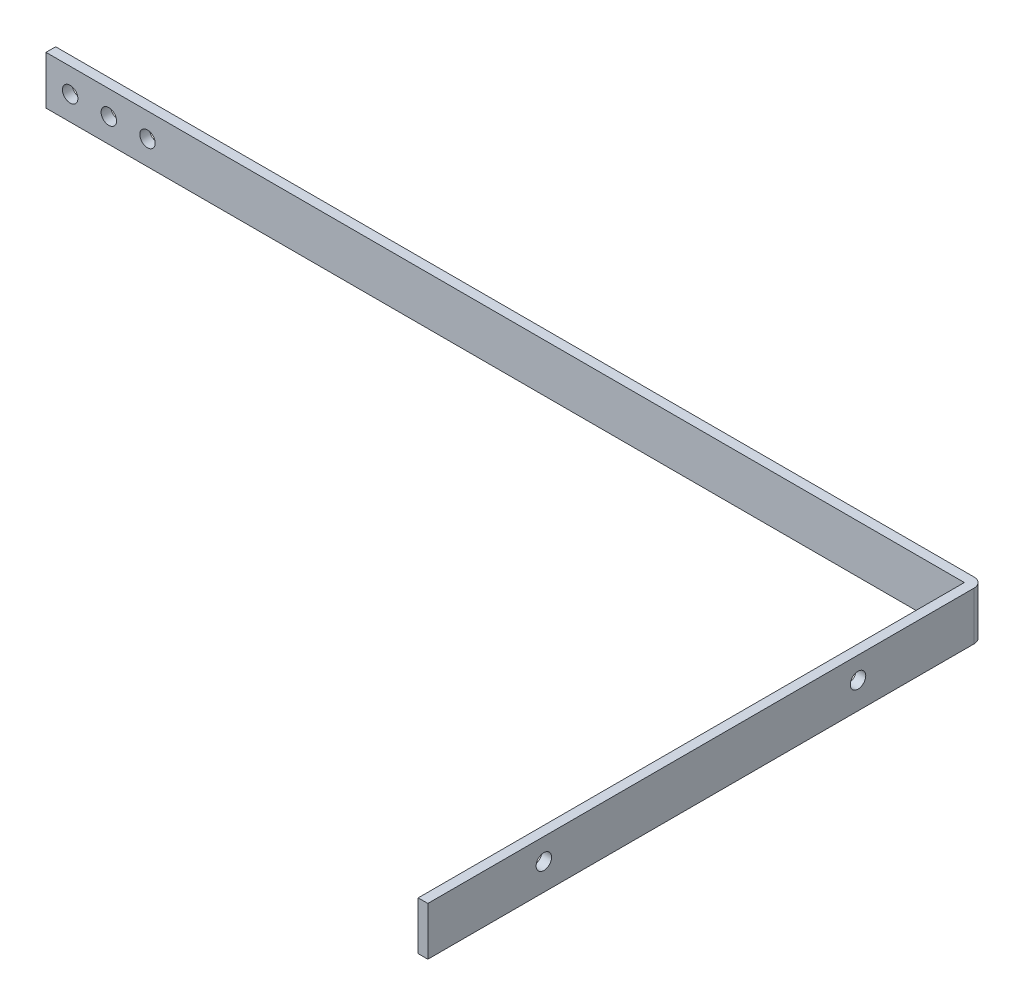
from build123d import *

# Parameters (mm, degrees)
ESQUISSE1_W             = 190
ESQUISSE1_H             = 10
ESQUISSE1_R             = 1.6
BOSS_EXTRU_1_DEPTH      = 2
ESQUISSE2_W             = 2
ESQUISSE2_H             = 10
BOSS_EXTRU_2_DEPTH      = 115
CONG_1_R                = 2
ENL_V_MAT_EXTRU_1_REACH = 226.029
ESQUISSE3_R             = 1.6


with BuildPart() as part:
    # Esquisse1 → Boss.-Extru.1 (new body)
    with BuildSketch(Plane.XY):
        with Locations((95, 5)):
            Rectangle(ESQUISSE1_W, ESQUISSE1_H)
        with Locations((5, 5)):
            Circle(ESQUISSE1_R, mode=Mode.SUBTRACT)
        with Locations((13, 5)):
            Circle(ESQUISSE1_R, mode=Mode.SUBTRACT)
        with Locations((21, 5)):
            Circle(ESQUISSE1_R, mode=Mode.SUBTRACT)
    extrude(amount=BOSS_EXTRU_1_DEPTH)

    # Esquisse2 → Boss.-Extru.2 (add)
    with BuildSketch(Plane.XY):
        with Locations((191, 5)):
            Rectangle(ESQUISSE2_W, ESQUISSE2_H)
    extrude(amount=BOSS_EXTRU_2_DEPTH)

    # Congé1
    cong_1_edges = [part.edges().sort_by_distance(p)[0] for p in [
        (192, 5, 0),
    ]]
    fillet(cong_1_edges, radius=CONG_1_R)

    # Esquisse3 → Enlèv. mat.-Extru.1 (cut, up to next)
    with BuildSketch(Plane(origin=(192, 0, 0), x_dir=(0, 0, -1), z_dir=(1, 0, 0)), mode=Mode.PRIVATE) as enl_v_mat_extru_1_sk1:
        with Locations((-91, 5.5)):
            Circle(ESQUISSE3_R)
    enl_v_mat_extru_1_tool1 = extrude(enl_v_mat_extru_1_sk1.sketch, amount=-ENL_V_MAT_EXTRU_1_REACH, mode=Mode.PRIVATE) & part.part
    # Esquisse3 → Enlèv. mat.-Extru.1 (cut, up to next)
    with BuildSketch(Plane(origin=(192, 0, 0), x_dir=(0, 0, -1), z_dir=(1, 0, 0)), mode=Mode.PRIVATE) as enl_v_mat_extru_1_sk2:
        with Locations((-26, 5.5)):
            Circle(ESQUISSE3_R)
    enl_v_mat_extru_1_tool2 = extrude(enl_v_mat_extru_1_sk2.sketch, amount=-ENL_V_MAT_EXTRU_1_REACH, mode=Mode.PRIVATE) & part.part
    add(enl_v_mat_extru_1_tool1.solids().sort_by_distance((192, 5.5, 91))[0], mode=Mode.SUBTRACT)
    add(enl_v_mat_extru_1_tool2.solids().sort_by_distance((192, 5.5, 26))[0], mode=Mode.SUBTRACT)


solid = part.part
